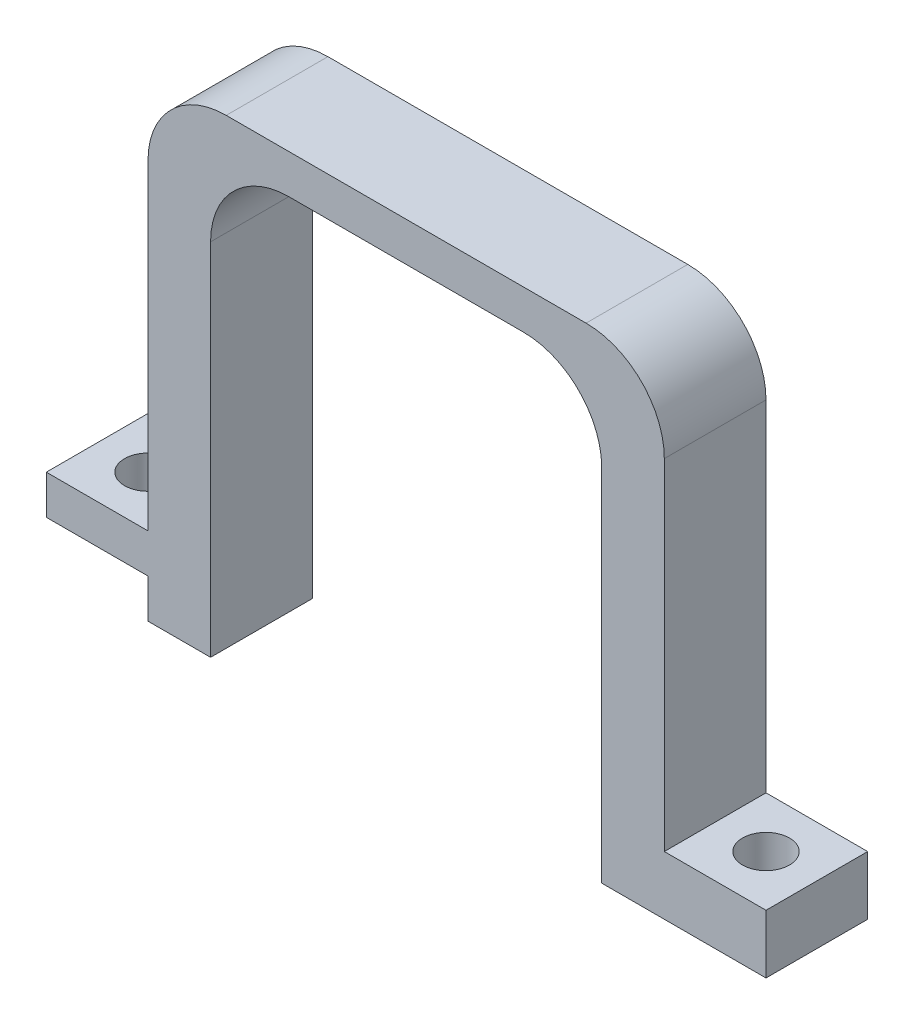
from build123d import *

# Parameters (mm, degrees)
EXTRUDE_1_DEPTH     = 2.6
FILLET_1_R          = 2
SKETCH_2_W          = 2.6
SKETCH_2_H          = 2.6
SKETCH_2_R          = 0.6
EXTRUDE_2_DEPTH     = 2
SKETCH_4_W          = 2.6
SKETCH_4_H          = 1
SKETCH_4_H_2        = 0.5
CUT_EXTRUDE_1_DEPTH = 12.340634903


with BuildPart() as part:
    # 草图1 → 凸台-拉伸1 (new body)
    with BuildSketch(Plane.XY):
        Polygon((6.6, 6.1), (-6.6, 6.1), (-6.6, -6.1), (-5, -6.1), (-5, 5.1), (5, 5.1), (5, -6.1), (6.6, -6.1), align=None)
    extrude(amount=EXTRUDE_1_DEPTH)

    # 圆角1
    fillet_1_edges = [part.edges().sort_by_distance(p)[0] for p in [
        (5, 5.1, 1.3),
        (-5, 5.1, 1.3),
        (-6.6, 6.1, 1.3),
        (6.6, 6.1, 1.3),
    ]]
    fillet(fillet_1_edges, radius=FILLET_1_R)

    # 草图2 → 凸台-拉伸2 (add)
    # profile 1 of 2: a face of its own
    with BuildSketch(Plane.XZ.offset(6.1)):
        with Locations((-7.9, 1.3)):
            Rectangle(SKETCH_2_W, SKETCH_2_H)
        with Locations(Location((-7.9, 1.3, 0), (0, 0, 270))):
            Circle(SKETCH_2_R, mode=Mode.SUBTRACT)
    # profile 2 of 2: a face of its own
    with BuildSketch(Plane.XZ.offset(6.1)):
        with Locations((7.9, 1.3)):
            Rectangle(SKETCH_2_W, SKETCH_2_H)
        with Locations(Location((7.9, 1.3, 0), (0, 0, 270))):
            Circle(SKETCH_2_R, mode=Mode.SUBTRACT)
    extrude(amount=-EXTRUDE_2_DEPTH)

    # 草图4 → 切除-拉伸1 (cut, through all)
    with BuildSketch(Plane.XY.offset(2.6)):
        with Locations((-7.9, -5.6)):
            Rectangle(SKETCH_4_W, SKETCH_4_H)
        with Locations((7.9, -4.35)):
            Rectangle(SKETCH_4_W, SKETCH_4_H_2)
    extrude(amount=-CUT_EXTRUDE_1_DEPTH, mode=Mode.SUBTRACT)


solid = part.part
